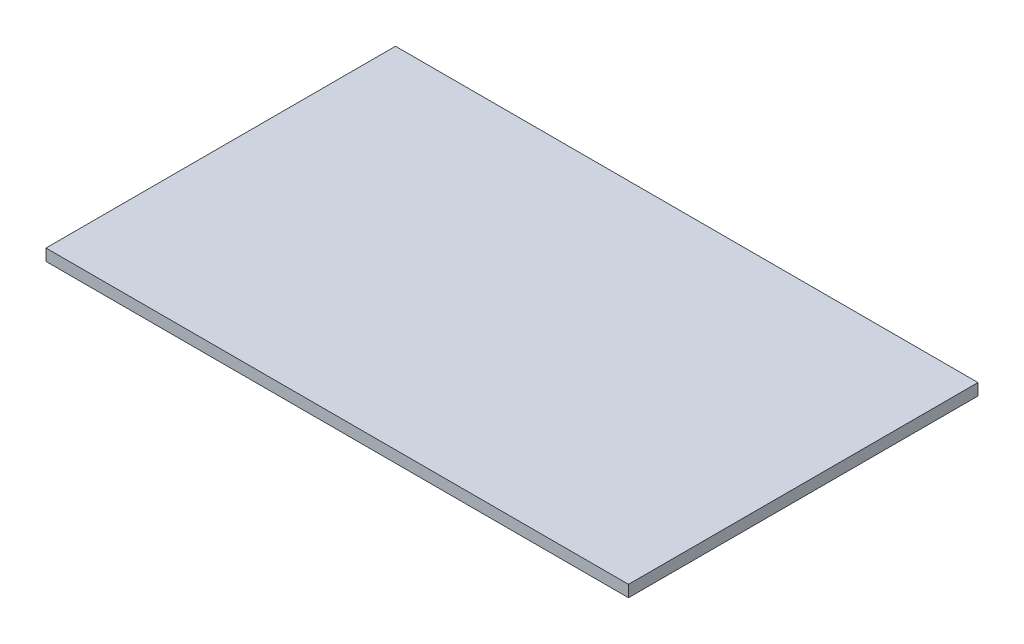
from build123d import *

# Parameters (mm, degrees)
SKETCH1_W           = 500
SKETCH1_H           = 300
BOSS_EXTRUDE1_DEPTH = 10


with BuildPart() as part:
    # Sketch1 → Boss-Extrude1 (new body)
    with BuildSketch(Plane(origin=(0, 0, 0), x_dir=(1, 0, 0), z_dir=(0, 1, 0))):
        with Locations((195.615833125, 107.53748547)):
            Rectangle(SKETCH1_W, SKETCH1_H)
    extrude(amount=BOSS_EXTRUDE1_DEPTH)


solid = part.part
